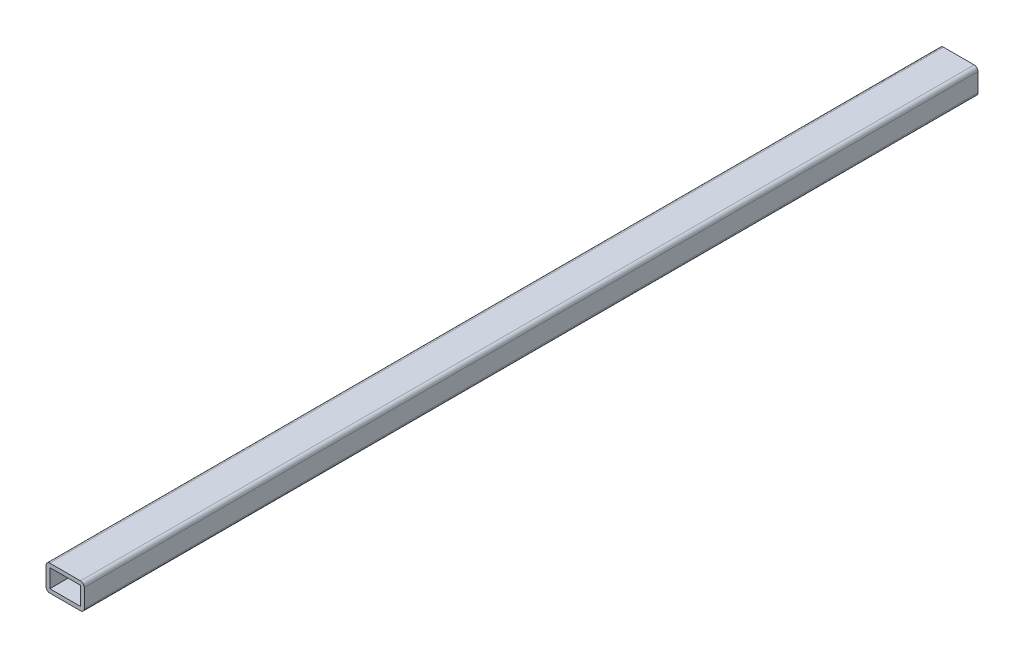
from build123d import *

# Parameters (mm, degrees)
SKETCH1_W           = 24
SKETCH1_H           = 14.33152787
BOSS_EXTRUDE1_DEPTH = 700


with BuildPart() as part:
    # Sketch1 → Boss-Extrude1 (new body)
    with BuildSketch(Plane.XY):
        with BuildLine():
            Line((3, 0), (27, 0))
            ThreePointArc((27, 0), (29.121320344, 0.878679656), (30, 3))
            Line((30, 3), (30, 17.33152787))
            ThreePointArc((30, 17.33152787), (29.121320344, 19.452848213), (27, 20.33152787))
            Line((27, 20.33152787), (3, 20.33152787))
            ThreePointArc((3, 20.33152787), (0.878679656, 19.452848213), (0, 17.33152787))
            Line((0, 17.33152787), (0, 3))
            ThreePointArc((0, 3), (0.878679656, 0.878679656), (3, 0))
        make_face()
        with Locations((15, 10.165763935)):
            Rectangle(SKETCH1_W, SKETCH1_H, mode=Mode.SUBTRACT)
    extrude(amount=BOSS_EXTRUDE1_DEPTH)


solid = part.part
